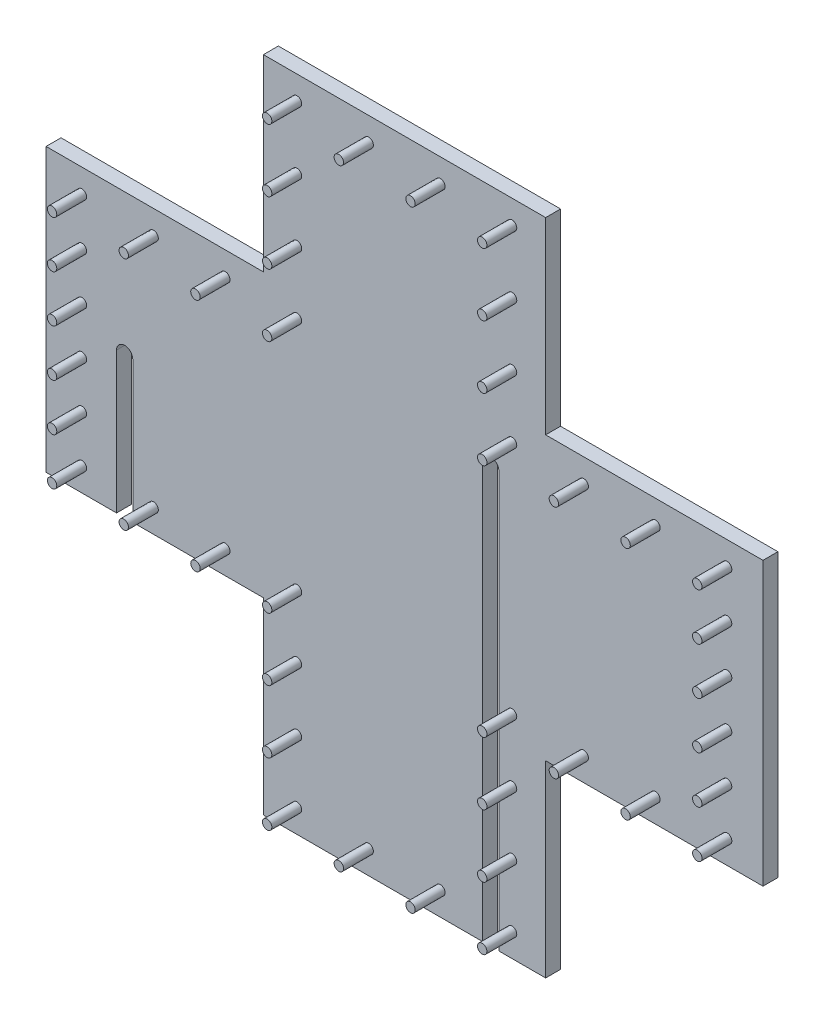
from build123d import *

# Parameters (mm, degrees)
BOSS_EXTRUDE1_DEPTH     = 1.5875
BOSS_EXTRUDE2_START     = 1.5875
SKETCH4_R               = 1
BOSS_EXTRUDE2_DEPTH     = 6.35
CUT_EXTRUDE1_DEPTH      = 212.336707427
CUT_EXTRUDE1_DEPTH_BACK = 212.336707427


with BuildPart() as part:
    # Sketch2 → Boss-Extrude1 (new, symmetric)
    with BuildSketch(Plane.XY):
        Polygon((46.2, -46.2), (0, -46.2), (0, -106.2), (46.2, -106.2), (46.2, -146.2), (106.2, -146.2), (106.2, -106.2), (152.4, -106.2), (152.4, -46.2), (106.2, -46.2), (106.2, -6.2), (46.2, -6.2), align=None)
    extrude(amount=BOSS_EXTRUDE1_DEPTH, both=True)

    # Sketch4 → Boss-Extrude2 (add)
    with BuildSketch(Plane.XY.offset(BOSS_EXTRUDE2_START)):
        with Locations((53.34, -11.2)):
            Circle(SKETCH4_R)
        with Locations((68.58, -11.2)):
            Circle(SKETCH4_R)
        with Locations((99.06, -11.2)):
            Circle(SKETCH4_R)
        with Locations((83.82, -11.2)):
            Circle(SKETCH4_R)
        with Locations((99.06, -24.533333333)):
            Circle(SKETCH4_R)
        with Locations((99.06, -37.866666667)):
            Circle(SKETCH4_R)
        with Locations((114.3, -51.2)):
            Circle(SKETCH4_R)
        with Locations((99.06, -51.2)):
            Circle(SKETCH4_R)
        with Locations((144.78, -51.2)):
            Circle(SKETCH4_R)
        with Locations((129.54, -51.2)):
            Circle(SKETCH4_R)
        with Locations((144.78, -61.2)):
            Circle(SKETCH4_R)
        with Locations((144.78, -71.2)):
            Circle(SKETCH4_R)
        with Locations((144.78, -81.2)):
            Circle(SKETCH4_R)
        with Locations((144.78, -91.2)):
            Circle(SKETCH4_R)
        with Locations((144.78, -101.2)):
            Circle(SKETCH4_R)
        with Locations((114.3, -101.2)):
            Circle(SKETCH4_R)
        with Locations((129.54, -101.2)):
            Circle(SKETCH4_R)
        with Locations((99.06, -101.2)):
            Circle(SKETCH4_R)
        with Locations((99.06, -114.533333333)):
            Circle(SKETCH4_R)
        with Locations((99.06, -127.866666667)):
            Circle(SKETCH4_R)
        with Locations((99.06, -141.2)):
            Circle(SKETCH4_R)
        with Locations((83.82, -141.2)):
            Circle(SKETCH4_R)
        with Locations((68.58, -141.2)):
            Circle(SKETCH4_R)
        with Locations((53.34, -141.2)):
            Circle(SKETCH4_R)
        with Locations((53.34, -127.866666667)):
            Circle(SKETCH4_R)
        with Locations((53.34, -114.533333333)):
            Circle(SKETCH4_R)
        with Locations((53.34, -101.2)):
            Circle(SKETCH4_R)
        with Locations((38.1, -101.2)):
            Circle(SKETCH4_R)
        with Locations((7.62, -101.2)):
            Circle(SKETCH4_R)
        with Locations((22.86, -101.2)):
            Circle(SKETCH4_R)
        with Locations((7.62, -91.2)):
            Circle(SKETCH4_R)
        with Locations((7.62, -81.2)):
            Circle(SKETCH4_R)
        with Locations((7.62, -71.2)):
            Circle(SKETCH4_R)
        with Locations((7.62, -51.2)):
            Circle(SKETCH4_R)
        with Locations((7.62, -61.2)):
            Circle(SKETCH4_R)
        with Locations((22.86, -51.2)):
            Circle(SKETCH4_R)
        with Locations((53.34, -51.2)):
            Circle(SKETCH4_R)
        with Locations((38.1, -51.2)):
            Circle(SKETCH4_R)
        with Locations((53.34, -37.866666667)):
            Circle(SKETCH4_R)
        with Locations((53.34, -24.533333333)):
            Circle(SKETCH4_R)
    extrude(amount=BOSS_EXTRUDE2_DEPTH)

    # Sketch3 → Cut-Extrude1 (cut, two sides: drawn at the far end of the back side and taken through both)
    with BuildSketch(Plane.XY.offset(-CUT_EXTRUDE1_DEPTH_BACK)):
        with BuildLine():
            Line((18.425, -76.2), (18.425, -109.794189798))
            ThreePointArc((18.425, -109.794189798), (16.7, -111.519189798), (14.975, -109.794189798))
            Line((14.975, -109.794189798), (14.975, -76.2))
            ThreePointArc((14.975, -76.2), (16.7, -74.475), (18.425, -76.2))
        make_face()
        with BuildLine():
            Line((96.2632, -57.8618), (96.2632, -157.352229572))
            ThreePointArc((96.2632, -157.352229572), (94.5382, -159.077229572), (92.8132, -157.352229572))
            Line((92.8132, -157.352229572), (92.8132, -57.8618))
            ThreePointArc((92.8132, -57.8618), (94.5382, -56.1368), (96.2632, -57.8618))
        make_face()
    extrude(amount=CUT_EXTRUDE1_DEPTH + CUT_EXTRUDE1_DEPTH_BACK, mode=Mode.SUBTRACT)


solid = part.part
